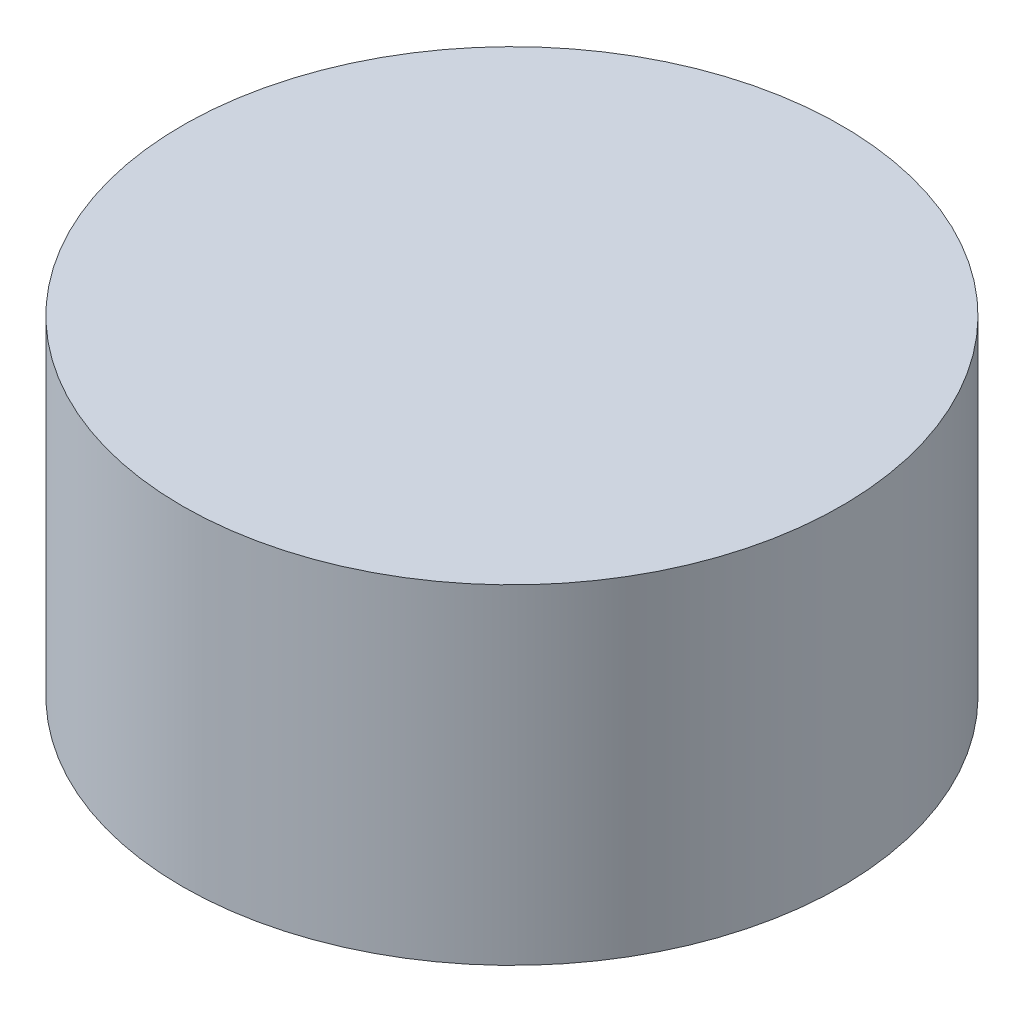
from build123d import *

# Parameters (mm, degrees)
SKETCH1_R           = 25.4
BOSS_EXTRUDE1_DEPTH = 25.4
SHELL1_T            = -2.54


with BuildPart() as part:
    # Sketch1 → Boss-Extrude1 (new body)
    with BuildSketch(Plane(origin=(0, 0, 0), x_dir=(1, 0, 0), z_dir=(0, 1, 0))):
        with Locations(Location((0, 0, 0), (0, 0, 270))):
            Circle(SKETCH1_R)
    extrude(amount=BOSS_EXTRUDE1_DEPTH)

    # Shell1
    shell1_openings = [part.faces().sort_by_distance(p)[0] for p in [
        (0, 0, 0),
    ]]
    offset(amount=SHELL1_T, openings=shell1_openings, kind=Kind.INTERSECTION)


solid = part.part
